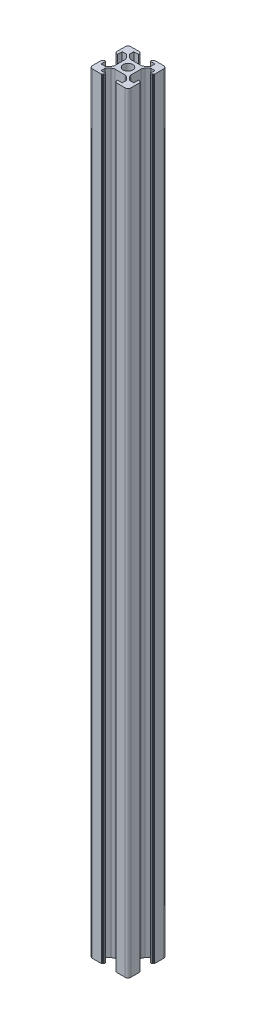
from build123d import *

# Parameters (mm, degrees)
BOSS_EXTRUDE1_DEPTH = 400
SKETCH3_R           = 2.5
CUT_EXTRUDE1_DEPTH  = 401.249921924
CIRPATTERN1_COUNT   = 4


with BuildPart() as part:
    # Sketch2 → Boss-Extrude1 (new body)
    with BuildSketch(Plane(origin=(0, 0, 0), x_dir=(1, 0, 0), z_dir=(0, 1, 0))):
        with BuildLine():
            Line((-10, -8.5), (-10, 8.5))
            ThreePointArc((-10, 8.5), (-9.560660172, 9.560660172), (-8.5, 10))
            Line((-8.5, 10), (8.5, 10))
            ThreePointArc((8.5, 10), (9.560660172, 9.560660172), (10, 8.5))
            Line((10, 8.5), (10, -8.5))
            ThreePointArc((10, -8.5), (9.560660172, -9.560660172), (8.5, -10))
            Line((8.5, -10), (-8.5, -10))
            ThreePointArc((-8.5, -10), (-9.560660172, -9.560660172), (-10, -8.5))
        make_face()
    extrude(amount=BOSS_EXTRUDE1_DEPTH)

    # Sketch3 → Cut-Extrude1 (cut, through all)
    with BuildSketch(Plane(origin=(0, 400, 0), x_dir=(1, 0, 0), z_dir=(0, 1, 0))):
        Circle(SKETCH3_R)
        with BuildLine():
            Line((-8.5, -5.5), (-6.348528137, -5.5))
            Line((-6.348528137, -5.5), (-4.785786438, -3.9372583))
            ThreePointArc((-4.785786438, -3.9372583), (-4.352240935, -3.288411603), (-4.2, -2.523044738))
            Line((-4.2, -2.523044738), (-4.2, 2.523044738))
            ThreePointArc((-4.2, 2.523044738), (-4.352240935, 3.288411603), (-4.785786438, 3.9372583))
            Line((-4.785786438, 3.9372583), (-6.348528137, 5.5))
            Line((-6.348528137, 5.5), (-8.5, 5.5))
            Line((-8.5, 5.5), (-8.5, 3.1))
            Line((-8.5, 3.1), (-9.3, 3.1))
            ThreePointArc((-9.3, 3.1), (-9.441421356, 3.158578644), (-9.5, 3.3))
            Line((-9.5, 3.3), (-9.5, 3.6))
            Line((-9.5, 3.6), (-9.8, 3.6))
            ThreePointArc((-9.8, 3.6), (-9.941421356, 3.658578644), (-10, 3.8))
            Line((-10, 3.8), (-10, -3.8))
            ThreePointArc((-10, -3.8), (-9.941421356, -3.658578644), (-9.8, -3.6))
            Line((-9.8, -3.6), (-9.5, -3.6))
            Line((-9.5, -3.6), (-9.5, -3.3))
            ThreePointArc((-9.5, -3.3), (-9.441421356, -3.158578644), (-9.3, -3.1))
            Line((-9.3, -3.1), (-8.5, -3.1))
            Line((-8.5, -3.1), (-8.5, -5.5))
        make_face()
    cut_extrude1 = extrude(amount=-CUT_EXTRUDE1_DEPTH, mode=Mode.SUBTRACT)

    # CirPattern1: Cut-Extrude1 ×4 about axis
    cirpattern1_axis = Axis((0, -20, 0), (0, 1, 0))
    for i in range(1, CIRPATTERN1_COUNT):
        add(cut_extrude1.rotate(cirpattern1_axis, i * 360 / CIRPATTERN1_COUNT), mode=Mode.SUBTRACT)


solid = part.part
